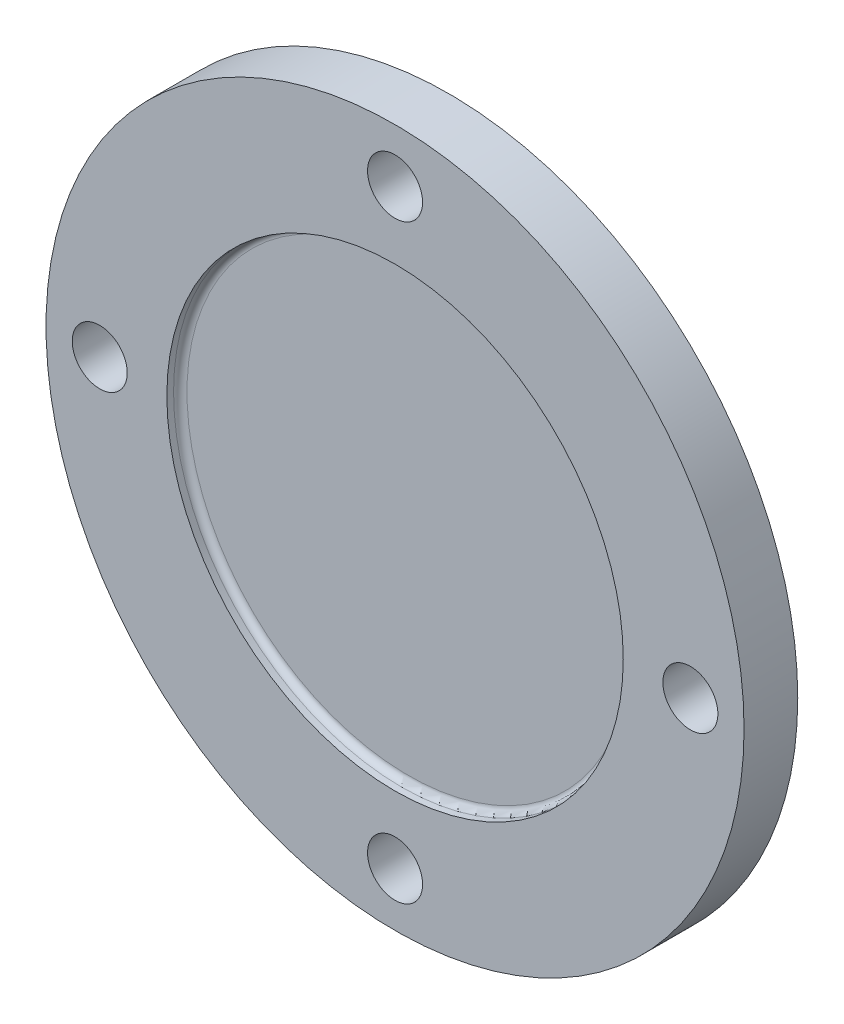
from build123d import *

# Parameters (mm, degrees)
SKETCH_1_R          = 52
SKETCH_1_R_2        = 4.1
EXTRUDE_1_DEPTH     = 8
SKETCH_2_R          = 34
CUT_EXTRUDE_1_DEPTH = 2
FILLET_1_R          = 1
SKETCH_3_R          = 34
SKETCH_3_R_2        = 25
EXTRUDE_2_DEPTH     = 11.3
FILLET_2_R          = 6


with BuildPart() as part:
    # Эскиз1 → Бобышка-Вытянуть1 (new body)
    with BuildSketch(Plane.XY):
        Circle(SKETCH_1_R)
        with Locations((0, 44)):
            Circle(SKETCH_1_R_2, mode=Mode.SUBTRACT)
        with Locations((44, 0)):
            Circle(SKETCH_1_R_2, mode=Mode.SUBTRACT)
        with Locations((0, -44)):
            Circle(SKETCH_1_R_2, mode=Mode.SUBTRACT)
        with Locations((-44, 0)):
            Circle(SKETCH_1_R_2, mode=Mode.SUBTRACT)
    extrude(amount=EXTRUDE_1_DEPTH)

    # Эскиз2 → Вырез-Вытянуть1 (cut)
    with BuildSketch(Plane.XY.offset(8)):
        Circle(SKETCH_2_R)
    extrude(amount=-CUT_EXTRUDE_1_DEPTH, mode=Mode.SUBTRACT)

    # Скругление1
    fillet_1_edges = [part.edges().sort_by_distance(p)[0] for p in [
        (-34, 0, 6),
    ]]
    fillet(fillet_1_edges, radius=FILLET_1_R)

    # Эскиз3 → Бобышка-Вытянуть2 (add)
    with BuildSketch(Plane(origin=(0, 0, 0), x_dir=(-1, 0, 0), z_dir=(0, 0, -1))):
        with Locations(Location((0, 0, 0), (0, 0, 180))):
            Circle(SKETCH_3_R)
        Circle(SKETCH_3_R_2, mode=Mode.SUBTRACT)
    extrude(amount=EXTRUDE_2_DEPTH)

    # Скругление2
    fillet_2_edges = [part.edges().sort_by_distance(p)[0] for p in [
        (25, 0, 0),
    ]]
    fillet(fillet_2_edges, radius=FILLET_2_R)


solid = part.part
